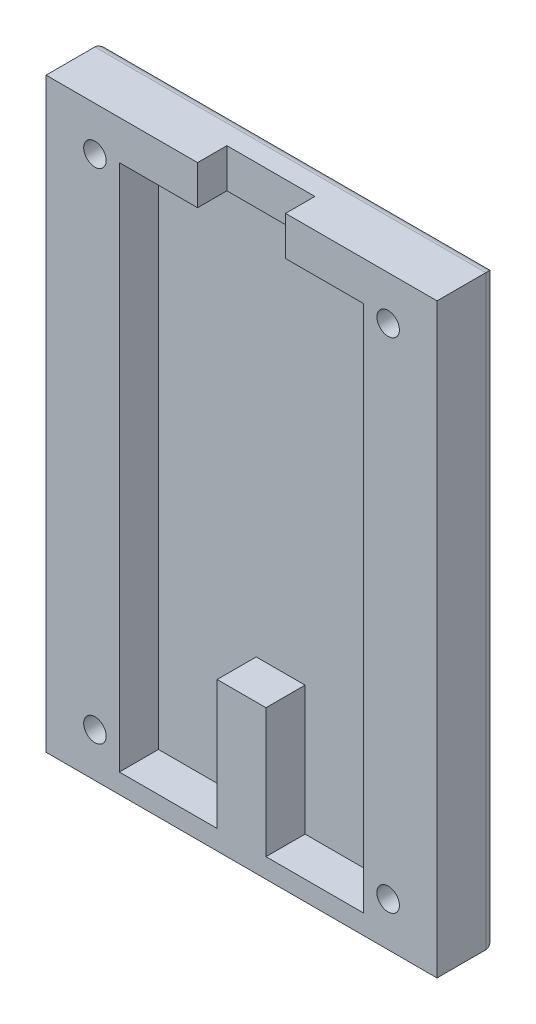
from build123d import *

# Parameters (mm, degrees)
SKETCH1_W           = 60
SKETCH1_H           = 40
BOSS_EXTRUDE1_DEPTH = 6
SKETCH3_R           = 1.15
CUT_EXTRUDE2_DEPTH  = 73.360210061
SKETCH12_W          = 25
SKETCH12_H          = 40.8
CUT_EXTRUDE10_DEPTH = 4
CUT_EXTRUDE11_DEPTH = 2.8
FILLET1_R           = 1
SKETCH14_W          = 10
SKETCH14_H          = 13.2
CUT_EXTRUDE12_DEPTH = 4
SKETCH15_W          = 9
SKETCH15_H          = 4
CUT_EXTRUDE13_DEPTH = 3


with BuildPart() as part:
    # Sketch1 → Boss-Extrude1 (new body)
    with BuildSketch(Plane(origin=(0, 0, 0), x_dir=(0, 1, 0), z_dir=(0, 0, 1))):
        with Locations((30, -20)):
            Rectangle(SKETCH1_W, SKETCH1_H)
    extrude(amount=BOSS_EXTRUDE1_DEPTH)

    # Sketch3 → Cut-Extrude2 (cut, through all)
    with BuildSketch(Plane.XY.offset(6)):
        with Locations((5, 4.5)):
            Circle(SKETCH3_R)
        with Locations((35, 4.5)):
            Circle(SKETCH3_R)
        with Locations((5, 55.5)):
            Circle(SKETCH3_R)
        with Locations((35, 55.5)):
            Circle(SKETCH3_R)
    extrude(amount=-CUT_EXTRUDE2_DEPTH, mode=Mode.SUBTRACT)

    # Sketch12 → Cut-Extrude10 (cut)
    with BuildSketch(Plane.XY.offset(6)):
        with Locations((20, 35.6)):
            Rectangle(SKETCH12_W, SKETCH12_H)
    extrude(amount=-CUT_EXTRUDE10_DEPTH, mode=Mode.SUBTRACT)

    # Sketch13 → Cut-Extrude11 (cut)
    with BuildSketch(Plane(origin=(0, 0, 0), x_dir=(1, 0, 0), z_dir=(0, 0, -1))):
        Polygon((7.424871131, -55.5), (6.212435565, -53.4), (3.787564435, -53.4), (2.575128869, -55.5), (3.787564435, -57.6), (6.212435565, -57.6), align=None)
        Polygon((32.575128869, -55.5), (33.787564435, -57.6), (36.212435565, -57.6), (37.424871131, -55.5), (36.212435565, -53.4), (33.787564435, -53.4), align=None)
        Polygon((7.424871131, -4.5), (6.212435565, -2.4), (3.787564435, -2.4), (2.575128869, -4.5), (3.787564435, -6.6), (6.212435565, -6.6), align=None)
        Polygon((32.575128869, -4.5), (33.787564435, -6.6), (36.212435565, -6.6), (37.424871131, -4.5), (36.212435565, -2.4), (33.787564435, -2.4), align=None)
    extrude(amount=-CUT_EXTRUDE11_DEPTH, mode=Mode.SUBTRACT)

    # Fillet1
    fillet1_edges = [part.edges().sort_by_distance(p)[0] for p in [
        (0, 30, 0),
        (20, 60, 0),
        (40, 30, 0),
        (20, 0, 0),
    ]]
    fillet(fillet1_edges, radius=FILLET1_R)

    # Sketch14 → Cut-Extrude12 (cut)
    with BuildSketch(Plane.XY.offset(6)):
        with Locations((12.5, 8.6)):
            Rectangle(SKETCH14_W, SKETCH14_H)
        with Locations((27.5, 8.6)):
            Rectangle(SKETCH14_W, SKETCH14_H)
    extrude(amount=-CUT_EXTRUDE12_DEPTH, mode=Mode.SUBTRACT)

    # Sketch15 → Cut-Extrude13 (cut)
    with BuildSketch(Plane.XY.offset(6)):
        with Locations((20, 58)):
            Rectangle(SKETCH15_W, SKETCH15_H)
    extrude(amount=-CUT_EXTRUDE13_DEPTH, mode=Mode.SUBTRACT)


solid = part.part
